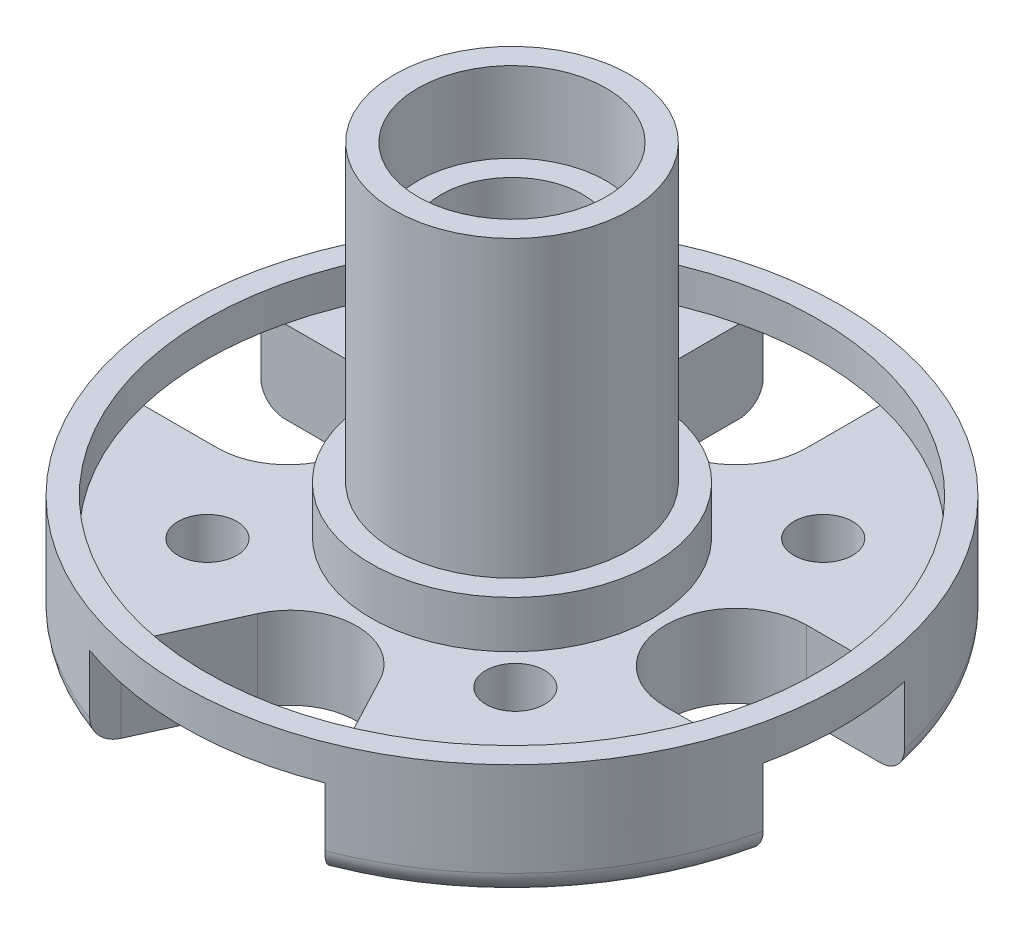
from build123d import *

# Parameters (mm, degrees)
CONG_1_R                     = 1
ENL_V_MAT_EXTRU_1_REACH      = 29.308
R_P_TITION_CIRCULAIRE2_COUNT = 3
R_P_TITION_CIRCULAIRE2_ANGLE = 180
ENL_V_START                  = -3.5
ENL_V_MAT_EXTRU_2_DEPTH      = 3.5
TROU_TARAUD_M3X0_52_D        = 2.5


with BuildPart() as part:
    # Esquisse3 → Révolution1 (revolve)
    with BuildSketch(Plane.XY):
        Polygon((-12.974994046, -8.820980619), (-12.974994046, -3.820980619), (-11.974994046, -3.820980619), (-11.974994046, -5.320980619), (-4.974994046, -5.320980619), (-4.974994046, -3.320980619), (-3.974994046, -3.320980619), (-3.974994046, 9.179019381), (-2.974994046, 9.179019381), (-2.974994046, 5.770549628), (-1.974994046, 5.770549628), (-1.974994046, -4.820980619), (-2.974994046, -4.820980619), (-2.974994046, -8.820980619), align=None)
    revolve(axis=Axis((1.025005954, 13.743921907, 0), (0, -1, 0)))

    # Congé1
    cong_1_edges = [part.edges().sort_by_distance(p)[0] for p in [
        (15.025005954, -8.820980619, 0),
    ]]
    fillet(cong_1_edges, radius=CONG_1_R)

    # Enlèv. mat.-Extru.1: up to this face of the body (flat: up to its plane)
    enl_v_mat_extru_1_end = Plane(part.part.faces().sort_by_distance((13.657310428, -5.320980619, 0))[0])
    # Esquisse5 → Enlèv. mat.-Extru.1 (cut, up to the picked face)
    with BuildSketch(Plane.XZ.offset(8.820980619), mode=Mode.PRIVATE) as enl_v_mat_extru_1_sk1:
        with BuildLine():
            Line((13.674116595, 3), (10.546683691, 3))
            ThreePointArc((10.546683691, 3), (7.546683691, 0), (10.546683691, -3))
            Line((10.546683691, -3), (13.674116595, -3))
            Line((13.674116595, -3), (14.699800285, -3))
            Line((14.699800285, -3), (15.031061769, -3))
            ThreePointArc((15.031061769, -3), (15.351470019, 0), (15.031061769, 3))
            Line((15.031061769, 3), (14.699800285, 3))
            Line((14.699800285, 3), (13.674116595, 3))
        make_face()
    enl_v_mat_extru_1_tool1 = split(extrude(enl_v_mat_extru_1_sk1.sketch, amount=-ENL_V_MAT_EXTRU_1_REACH, mode=Mode.PRIVATE), bisect_by=enl_v_mat_extru_1_end, keep=Keep.BOTH, mode=Mode.PRIVATE)
    enl_v_mat_extru_1 = enl_v_mat_extru_1_tool1.solids().sort_by(Axis((11.686689, -8.820981, 0), (0, 1, 0)))[0]
    add(enl_v_mat_extru_1, mode=Mode.SUBTRACT)

    # Répétition circulaire2: Enlèv. mat.-Extru.1 ×3 about axis
    r_p_tition_circulaire2_axis = Axis((1.025005954, 0, 0), (0, 1, 0))
    for i in range(1, R_P_TITION_CIRCULAIRE2_COUNT):
        add(enl_v_mat_extru_1.rotate(r_p_tition_circulaire2_axis, i * R_P_TITION_CIRCULAIRE2_ANGLE / (R_P_TITION_CIRCULAIRE2_COUNT - 1)), mode=Mode.SUBTRACT)

    # Esquisse7 → Enlèv. mat.-Extru.2 (cut)
    with BuildSketch(Plane.XZ.offset(8.820980619).offset(ENL_V_START)):
        with BuildLine():
            Line((-3.356038211, 12.2395446), (-1.541479015, 8.2395446))
            ThreePointArc((-1.541479015, 8.2395446), (0.968033239, 6.591412228), (3.533049808, 8.151759008))
            Line((3.533049808, 8.151759008), (5.643961789, 12.151759008))
            Line((5.643961789, 12.151759008), (6.71991785, 14.19060491))
            ThreePointArc((6.71991785, 14.19060491), (1.235603593, 15.289242553), (-4.276890033, 14.34207754))
            Line((-4.276890033, 14.34207754), (-3.356038211, 12.2395446))
        make_face()
    extrude(amount=ENL_V_MAT_EXTRU_2_DEPTH, mode=Mode.SUBTRACT)

    # Trou taraudé M3x0.52 (through all)
    with Locations(Plane(origin=(-5.37489391, -5.320980619, 6.540737726), x_dir=(1, 0, 0), z_dir=(0, 1, 0))):
        with Locations((0, 0), (1.060660172, 12.02081528), (12.020815281, 1.060660172), (13.081475452, 13.081475452)):
            Hole(TROU_TARAUD_M3X0_52_D / 2)


solid = part.part
